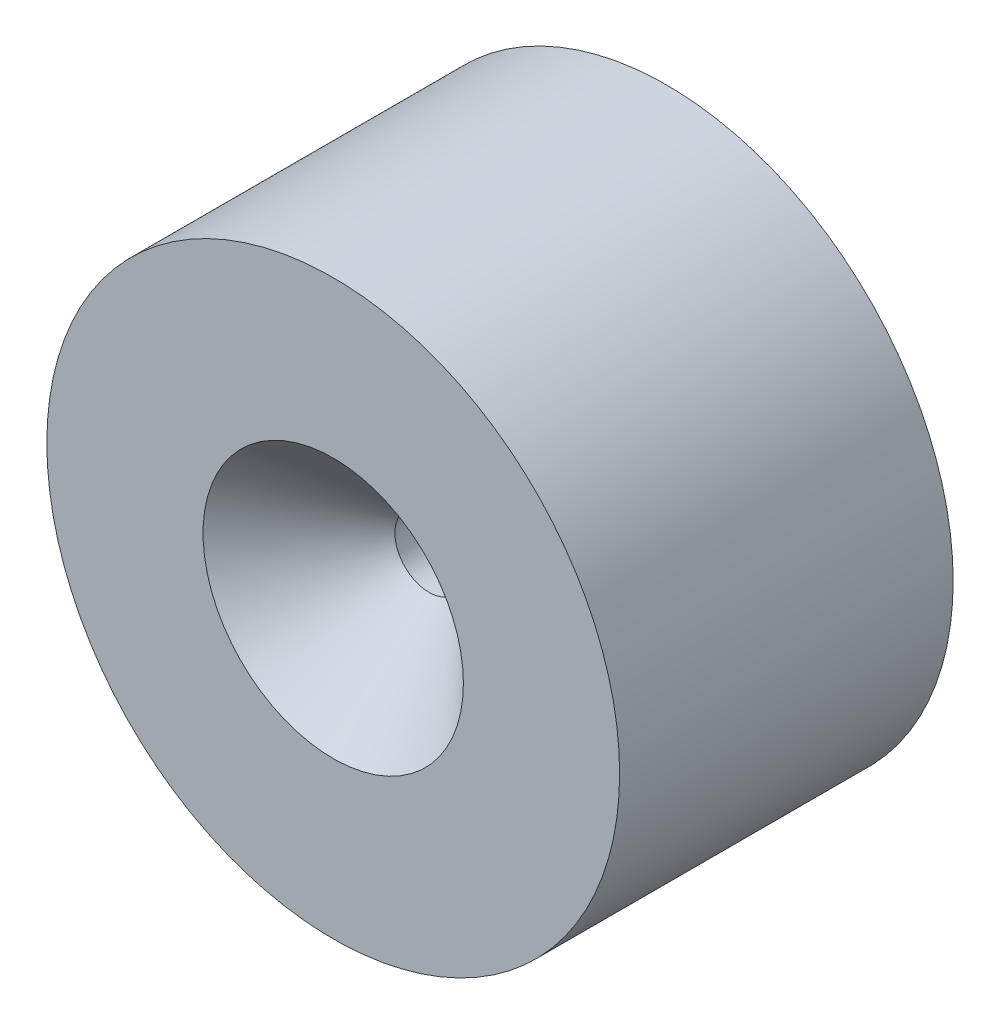
from build123d import *

# Parameters (mm, degrees)
SKETCH1_R           = 26.543
BOSS_EXTRUDE1_DEPTH = 30.9118


with BuildPart() as part:
    # Sketch1 → Boss-Extrude1 (new body)
    with BuildSketch(Plane.XY):
        Circle(SKETCH1_R)
    extrude(amount=BOSS_EXTRUDE1_DEPTH)

    # Sketch2 → Cut-Revolve1 (revolve, cut)
    with BuildSketch(Plane(origin=(0, 0, 0), x_dir=(0, 0, -1), z_dir=(1, 0, 0))):
        Polygon((-30.9118, 12.065), (-22.0218, 3.175), (-18.2118, 3.175), (0, 4.7752), (0, 0), (-30.9118, 0), align=None)
    revolve(axis=Axis((0, 0, 0), (0, 0, 1)), mode=Mode.SUBTRACT)


solid = part.part
